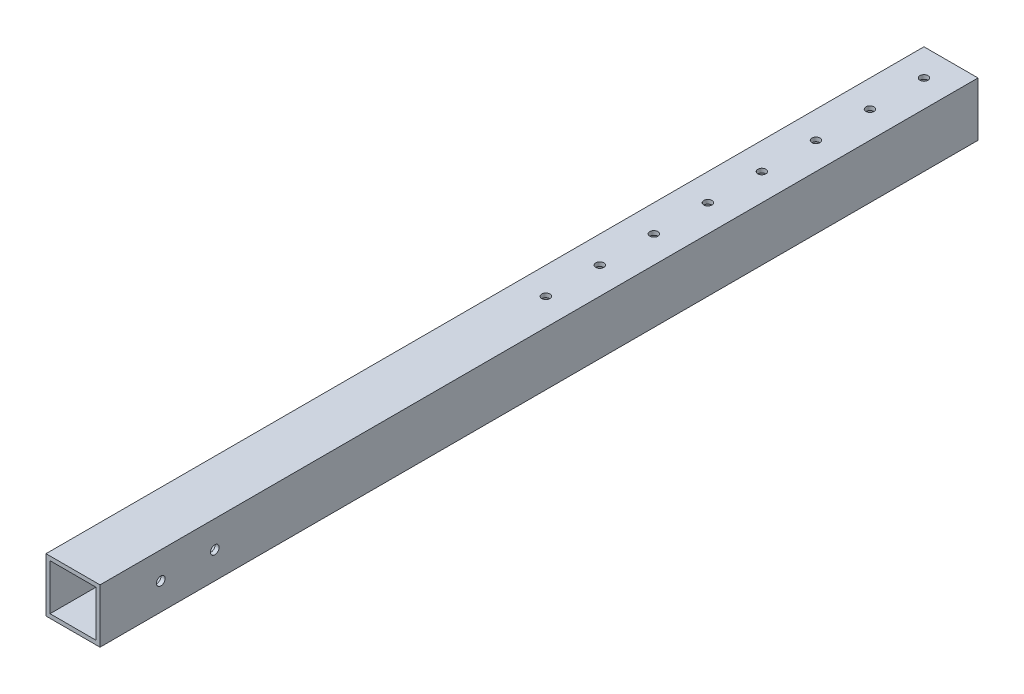
from build123d import *

# Parameters (mm, degrees)
SKETCH_1_W          = 20
SKETCH_1_H          = 20
SKETCH_1_W_2        = 17
SKETCH_1_H_2        = 17
EXTRUDE_1_DEPTH     = 325.04
SKETCH_4_R          = 1.6
CUT_EXTRUDE_3_DEPTH = 326.808228257
SKETCH_6_R          = 1.5
CUT_EXTRUDE_5_DEPTH = 326.808228257


with BuildPart() as part:
    # 草图1 → 凸台-拉伸1 (new body)
    with BuildSketch(Plane.XY):
        Rectangle(SKETCH_1_W, SKETCH_1_H)
        Rectangle(SKETCH_1_W_2, SKETCH_1_H_2, mode=Mode.SUBTRACT)
    extrude(amount=EXTRUDE_1_DEPTH)

    # 草图4 → 切除-拉伸3 (cut, through all)
    with BuildSketch(Plane.ZY.offset(10)):
        with Locations(Location((282.54, 0, 0), (0, 0, 270))):
            Circle(SKETCH_4_R)
        with Locations(Location((302.54, 0, 0), (0, 0, 270))):
            Circle(SKETCH_4_R)
    extrude(amount=-CUT_EXTRUDE_3_DEPTH, mode=Mode.SUBTRACT)

    # 草图6 → 切除-拉伸5 (cut, through all)
    with BuildSketch(Plane(origin=(0, 10, 0), x_dir=(1, 0, 0), z_dir=(0, 1, 0))):
        with Locations(Location((0, -10, 0), (0, 0, 270))):
            Circle(SKETCH_6_R)
        with Locations(Location((0, -30, 0), (0, 0, 270))):
            Circle(SKETCH_6_R)
        with Locations(Location((0, -50, 0), (0, 0, 270))):
            Circle(SKETCH_6_R)
        with Locations(Location((0, -70, 0), (0, 0, 270))):
            Circle(SKETCH_6_R)
        with Locations(Location((0, -90, 0), (0, 0, 270))):
            Circle(SKETCH_6_R)
        with Locations(Location((0, -110, 0), (0, 0, 270))):
            Circle(SKETCH_6_R)
        with Locations(Location((0, -130, 0), (0, 0, 270))):
            Circle(SKETCH_6_R)
        with Locations(Location((0, -150, 0), (0, 0, 270))):
            Circle(SKETCH_6_R)
    extrude(amount=-CUT_EXTRUDE_5_DEPTH, mode=Mode.SUBTRACT)


solid = part.part
